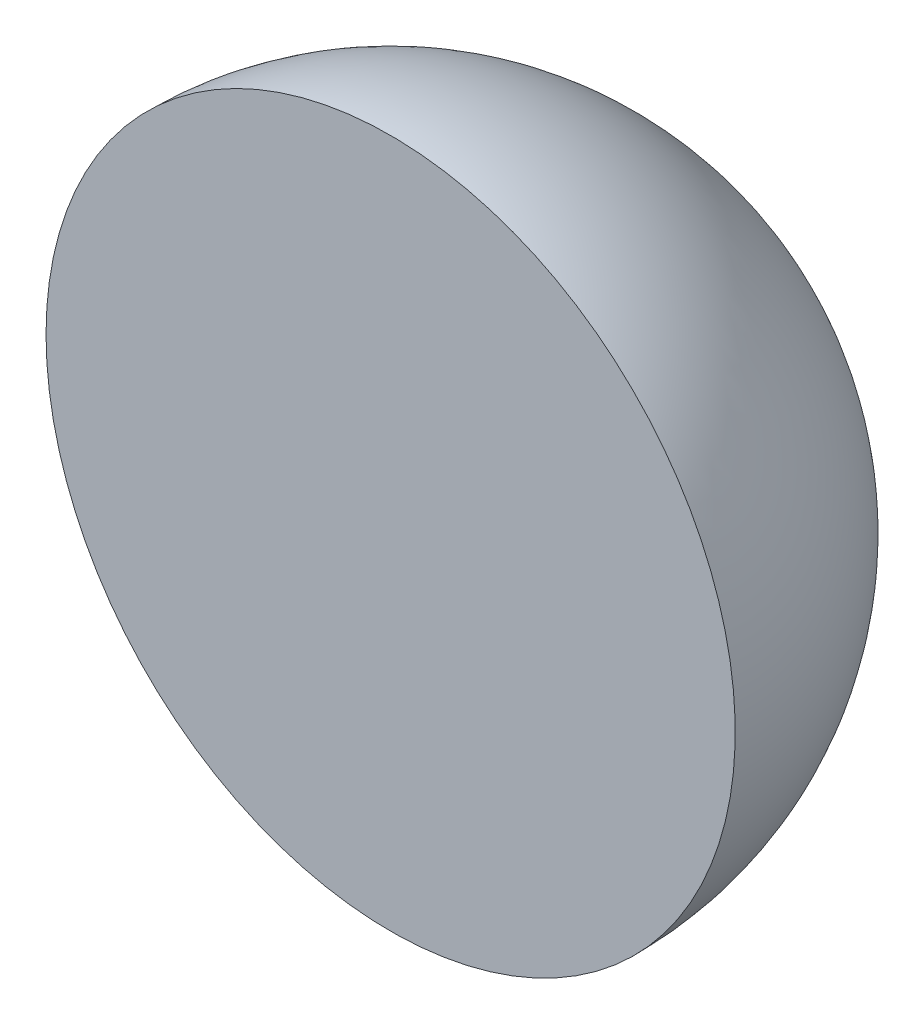
from build123d import *


with BuildPart() as part:
    # ｽｹｯﾁ1 one side → 回転2 (revolve)
    with BuildSketch(Plane(origin=(0, 0, 0), x_dir=(1, 0, 0), z_dir=(0, 1, 0))):
        with BuildLine():
            Line((-7.0145e-05, 9.3258e-05), (4.999929855, 9.3258e-05))
            ThreePointArc((4.999929855, 9.3258e-05), (3.53540599, 3.535521533), (-7.0145e-05, 4.999929855))
            Line((-7.0145e-05, 4.999929855), (-7.0145e-05, 9.3258e-05))
        make_face()
    revolve(axis=Axis((-7.0145e-05, 0, -4.999929855), (0, 0, 1)))


solid = part.part
